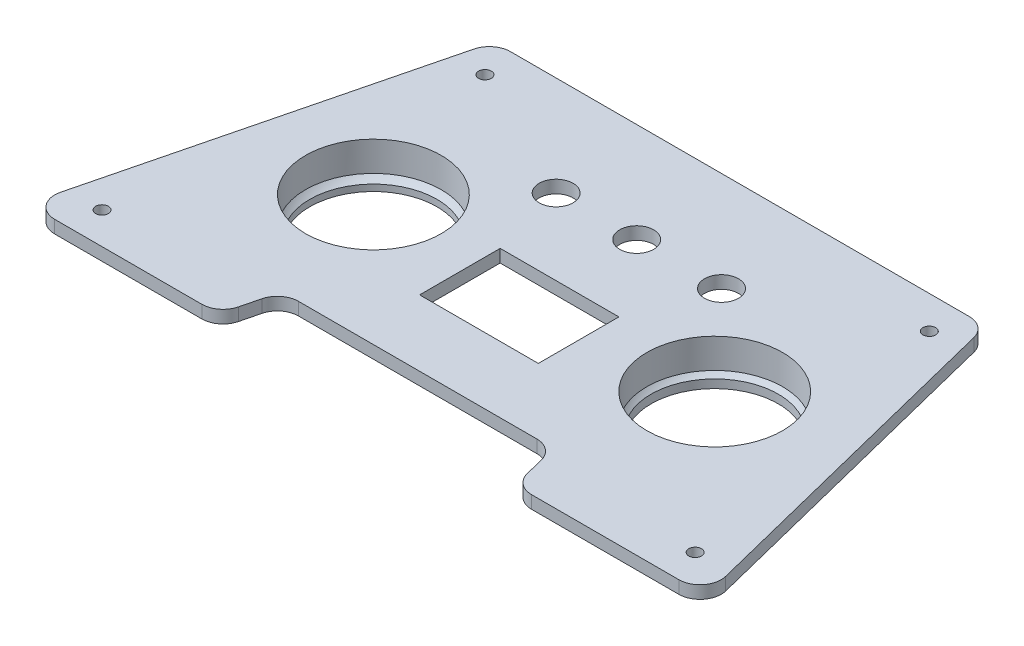
from build123d import *

# Parameters (mm, degrees)
Y_KSEKLIK_EKSTR_ZYON1_DEPTH = 3
IZIM2_R                     = 16
KES_EKSTR_ZYON1_DEPTH       = 10
IZIM3_R                     = 1.5
KES_EKSTR_ZYON2_DEPTH       = 10
IZIM4_R                     = 4
KES_EKSTR_ZYON3_DEPTH       = 10
IZIM5_W                     = 28
IZIM5_H                     = 23
KES_EKSTR_ZYON4_DEPTH       = 10
IZIM6_W                     = 33
IZIM6_H                     = 31
KES_EKSTR_ZYON5_DEPTH       = 1.5
IZIM7_R                     = 18
IZIM7_R_2                   = 16
Y_KSEKLIK_EKSTR_ZYON2_DEPTH = 4
RADYUS1_R                   = 1
Y_KSEKLIK_EKSTR_ZYON3_START = -1.5
Y_KSEKLIK_EKSTR_ZYON3_DEPTH = 1.5
KES_EKSTR_ZYON6_DEPTH       = 4
IZIM12_W                    = 28
IZIM12_H                    = 19
KES_EKSTR_ZYON7_DEPTH       = 10
IZIM13_W                    = 33
IZIM13_H                    = 31
IZIM13_W_2                  = 28
IZIM13_H_2                  = 19
Y_KSEKLIK_EKSTR_ZYON4_DEPTH = 1.5
IZIM14_W                    = 28
IZIM14_H                    = 2.5
KES_EKSTR_ZYON8_DEPTH       = 10
IZIM15_W                    = 28
IZIM15_H                    = 2.5
Y_KSEKLIK_EKSTR_ZYON5_DEPTH = 3


with BuildPart() as part:
    # Çizim1 → Yükseklik-Ekstrüzyon1 (new body)
    with BuildSketch(Plane(origin=(0, 0, 0), x_dir=(1, 0, 0), z_dir=(0, 1, 0))):
        with BuildLine():
            Line((3.903882032, 0), (112.096117968, 0))
            ThreePointArc((112.096117968, 0), (115.173179015, -1.05897281), (116.946830469, -3.787321875))
            Line((116.946830469, -3.787321875), (136.446830469, -81.787321875))
            ThreePointArc((136.446830469, -81.787321875), (135.537145158, -86.077061047), (131.596117968, -88))
            Line((131.596117968, -88), (96.903882032, -88))
            ThreePointArc((96.903882032, -88), (93.826820985, -86.94102719), (92.053169531, -84.212678125))
            Line((92.053169531, -84.212678125), (90.946830469, -79.787321875))
            ThreePointArc((90.946830469, -79.787321875), (89.173179015, -77.05897281), (86.096117968, -76))
            Line((86.096117968, -76), (29.903882032, -76))
            ThreePointArc((29.903882032, -76), (26.826820985, -77.05897281), (25.053169531, -79.787321875))
            Line((25.053169531, -79.787321875), (23.946830469, -84.212678125))
            ThreePointArc((23.946830469, -84.212678125), (22.173179015, -86.94102719), (19.096117968, -88))
            Line((19.096117968, -88), (-15.596117968, -88))
            ThreePointArc((-15.596117968, -88), (-19.537145158, -86.077061047), (-20.446830469, -81.787321875))
            Line((-20.446830469, -81.787321875), (-0.946830469, -3.787321875))
            ThreePointArc((-0.946830469, -3.787321875), (0.826820985, -1.05897281), (3.903882032, 0))
        make_face()
    extrude(amount=Y_KSEKLIK_EKSTR_ZYON1_DEPTH)

    # Çizim2 → Kes-Ekstrüzyon1 (cut)
    with BuildSketch(Plane(origin=(0, 3, 0), x_dir=(1, 0, 0), z_dir=(0, 1, 0))):
        with Locations(Location((16.91, -45.35, 0), (0, 0, 270))):
            Circle(IZIM2_R)
        with Locations(Location((97.41, -45.35, 0), (0, 0, 270))):
            Circle(IZIM2_R)
    extrude(amount=-KES_EKSTR_ZYON1_DEPTH, mode=Mode.SUBTRACT)

    # Çizim3 → Kes-Ekstrüzyon2 (cut)
    with BuildSketch(Plane(origin=(0, 3, 0), x_dir=(1, 0, 0), z_dir=(0, 1, 0))):
        with Locations(Location((5.6, -7.73, 0), (0, 0, 270))):
            Circle(IZIM3_R)
        with Locations(Location((-11.94, -80.5, 0), (0, 0, 270))):
            Circle(IZIM3_R)
        with Locations(Location((127.94, -80.5, 0), (0, 0, 90))):
            Circle(IZIM3_R)
        with Locations(Location((110.4, -7.73, 0), (0, 0, 90))):
            Circle(IZIM3_R)
    extrude(amount=-KES_EKSTR_ZYON2_DEPTH, mode=Mode.SUBTRACT)

    # Çizim4 → Kes-Ekstrüzyon3 (cut)
    with BuildSketch(Plane(origin=(0, 3, 0), x_dir=(1, 0, 0), z_dir=(0, 1, 0))):
        with Locations(Location((38.16, -23.5, 0), (0, 0, 270))):
            Circle(IZIM4_R)
        with Locations(Location((57.16, -23.5, 0), (0, 0, 270))):
            Circle(IZIM4_R)
        with Locations(Location((77.16, -23.5, 0), (0, 0, 270))):
            Circle(IZIM4_R)
    extrude(amount=-KES_EKSTR_ZYON3_DEPTH, mode=Mode.SUBTRACT)

    # Çizim5 → Kes-Ekstrüzyon4 (cut)
    with BuildSketch(Plane(origin=(0, 3, 0), x_dir=(1, 0, 0), z_dir=(0, 1, 0))):
        with Locations((57.16, -52.3)):
            Rectangle(IZIM5_W, IZIM5_H)
    extrude(amount=-KES_EKSTR_ZYON4_DEPTH, mode=Mode.SUBTRACT)

    # Çizim6 → Kes-Ekstrüzyon5 (cut)
    with BuildSketch(Plane(origin=(0, 3, 0), x_dir=(1, 0, 0), z_dir=(0, 1, 0))):
        with Locations((57.16, -52.3)):
            Rectangle(IZIM6_W, IZIM6_H)
    extrude(amount=-KES_EKSTR_ZYON5_DEPTH, mode=Mode.SUBTRACT)

    # Çizim7 → Yükseklik-Ekstrüzyon2 (add)
    # profile 1 of 2: a face of its own
    with BuildSketch(Plane.XZ):
        with Locations(Location((97.41, 45.35, 0), (0, 0, 270))):
            Circle(IZIM7_R)
        with Locations(Location((97.41, 45.35, 0), (0, 0, 90))):
            Circle(IZIM7_R_2, mode=Mode.SUBTRACT)
    # profile 2 of 2: a face of its own
    with BuildSketch(Plane.XZ):
        with Locations(Location((16.91, 45.35, 0), (0, 0, 270))):
            Circle(IZIM7_R)
        with Locations(Location((16.91, 45.35, 0), (0, 0, 90))):
            Circle(IZIM7_R_2, mode=Mode.SUBTRACT)
    extrude(amount=Y_KSEKLIK_EKSTR_ZYON2_DEPTH)

    # Çizim8 → Döndür1 (revolve)
    with BuildSketch(Plane.XY.offset(45.35), mode=Mode.PRIVATE) as d_nd_r1_sk:
        with BuildLine():
            Line((112.41, -5.015624143), (112.41, -7))
            ThreePointArc((112.41, -7), (114.070930331, -5.660930331), (115.41, -4))
            Line((115.41, -4), (113.425624143, -4))
            ThreePointArc((113.425624143, -4), (112.939559481, -4.529559481), (112.41, -5.015624143))
        make_face()
    revolve(d_nd_r1_sk.sketch.rotate(Axis((97.41, -4, 45.35), (0, -1, 0)), 90), axis=Axis((97.41, -4, 45.35), (0, -1, 0)))

    # Çizim9 → Döndür2 (revolve)
    with BuildSketch(Plane.XY.offset(45.35), mode=Mode.PRIVATE) as d_nd_r2_sk:
        with BuildLine():
            Line((31.91, -5.473337822), (31.91, -7))
            ThreePointArc((31.91, -7), (33.570930331, -5.660930331), (34.91, -4))
            Line((34.91, -4), (33.383337822, -4))
            ThreePointArc((33.383337822, -4), (32.690654868, -4.780654868), (31.91, -5.473337822))
        make_face()
    revolve(d_nd_r2_sk.sketch.rotate(Axis((16.91, -4, 45.35), (0, -1, 0)), 180), axis=Axis((16.91, -4, 45.35), (0, -1, 0)))

    # Radyus1
    radyus1_edges = [part.edges().sort_by_distance(p)[0] for p in [
        (97.41, 0, 63.35),
        (16.91, 0, 63.35),
    ]]
    fillet(radyus1_edges, radius=RADYUS1_R)

    # Çizim10 → Yükseklik-Ekstrüzyon3 (add)
    with BuildSketch(Plane(origin=(0, 0, 0), x_dir=(-1, 0, 0), z_dir=(0, -1, 0)).offset(Y_KSEKLIK_EKSTR_ZYON3_START)):
        Polygon((-70.36, -40.8), (-70.36, -56.3), (-43.16, -56.3), (-43.16, -63.8), (-71.16, -63.8), (-71.16, -40.8), align=None)
    extrude(amount=Y_KSEKLIK_EKSTR_ZYON3_DEPTH)

    # Çizim11 → Kes-Ekstrüzyon6 (cut)
    with BuildSketch(Plane.XZ):
        Polygon((42.86, 40.5), (42.86, 56.3), (43.16, 56.3), (43.16, 40.8), (70.36, 40.8), (70.36, 40.5), align=None)
    extrude(amount=-KES_EKSTR_ZYON6_DEPTH, mode=Mode.SUBTRACT)

    # Çizim12 → Kes-Ekstrüzyon7 (cut)
    with BuildSketch(Plane(origin=(0, 1.5, 0), x_dir=(1, 0, 0), z_dir=(0, 1, 0))):
        with Locations((56.86, -48.4)):
            Rectangle(IZIM12_W, IZIM12_H)
    extrude(amount=-KES_EKSTR_ZYON7_DEPTH, mode=Mode.SUBTRACT)

    # Çizim13 → Yükseklik-Ekstrüzyon4 (add)
    with BuildSketch(Plane(origin=(0, 1.5, 0), x_dir=(1, 0, 0), z_dir=(0, 1, 0))):
        with Locations((57.16, -52.3)):
            Rectangle(IZIM13_W, IZIM13_H)
        with Locations((56.86, -48.4)):
            Rectangle(IZIM13_W_2, IZIM13_H_2, mode=Mode.SUBTRACT)
    extrude(amount=Y_KSEKLIK_EKSTR_ZYON4_DEPTH)

    # Çizim14 → Kes-Ekstrüzyon8 (cut)
    with BuildSketch(Plane(origin=(0, 3, 0), x_dir=(1, 0, 0), z_dir=(0, 1, 0))):
        with Locations((56.86, -59.15)):
            Rectangle(IZIM14_W, IZIM14_H)
    extrude(amount=-KES_EKSTR_ZYON8_DEPTH, mode=Mode.SUBTRACT)

    # Çizim15 → Yükseklik-Ekstrüzyon5 (add)
    with BuildSketch(Plane(origin=(0, 3, 0), x_dir=(1, 0, 0), z_dir=(0, 1, 0))):
        with Locations((56.86, -40.15)):
            Rectangle(IZIM15_W, IZIM15_H)
    extrude(amount=-Y_KSEKLIK_EKSTR_ZYON5_DEPTH)


solid = part.part
